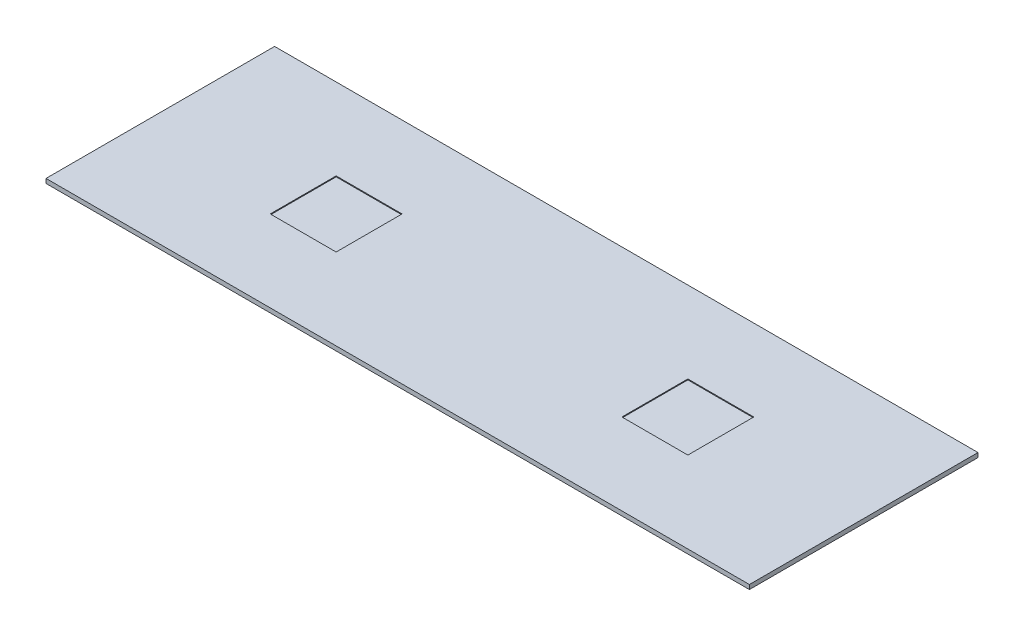
from build123d import *

# Parameters (mm, degrees)
SKETCH1_W           = 8000
SKETCH1_H           = 2600
BOSS_EXTRUDE1_DEPTH = 50
SKETCH2_W           = 750
SKETCH2_H           = 750
CUT_EXTRUDE1_DEPTH  = 10


with BuildPart() as part:
    # Sketch1 → Boss-Extrude1 (new body)
    with BuildSketch(Plane(origin=(0, 0, 0), x_dir=(1, 0, 0), z_dir=(0, 1, 0))):
        Rectangle(SKETCH1_W, SKETCH1_H)
    extrude(amount=BOSS_EXTRUDE1_DEPTH)

    # Sketch2 → Cut-Extrude1 (cut)
    with BuildSketch(Plane(origin=(0, 50, 0), x_dir=(1, 0, 0), z_dir=(0, 1, 0))):
        with Locations((-2000, 0)):
            Rectangle(SKETCH2_W, SKETCH2_H)
        with Locations((2000, 0)):
            Rectangle(SKETCH2_W, SKETCH2_H)
    extrude(amount=-CUT_EXTRUDE1_DEPTH, mode=Mode.SUBTRACT)


solid = part.part
